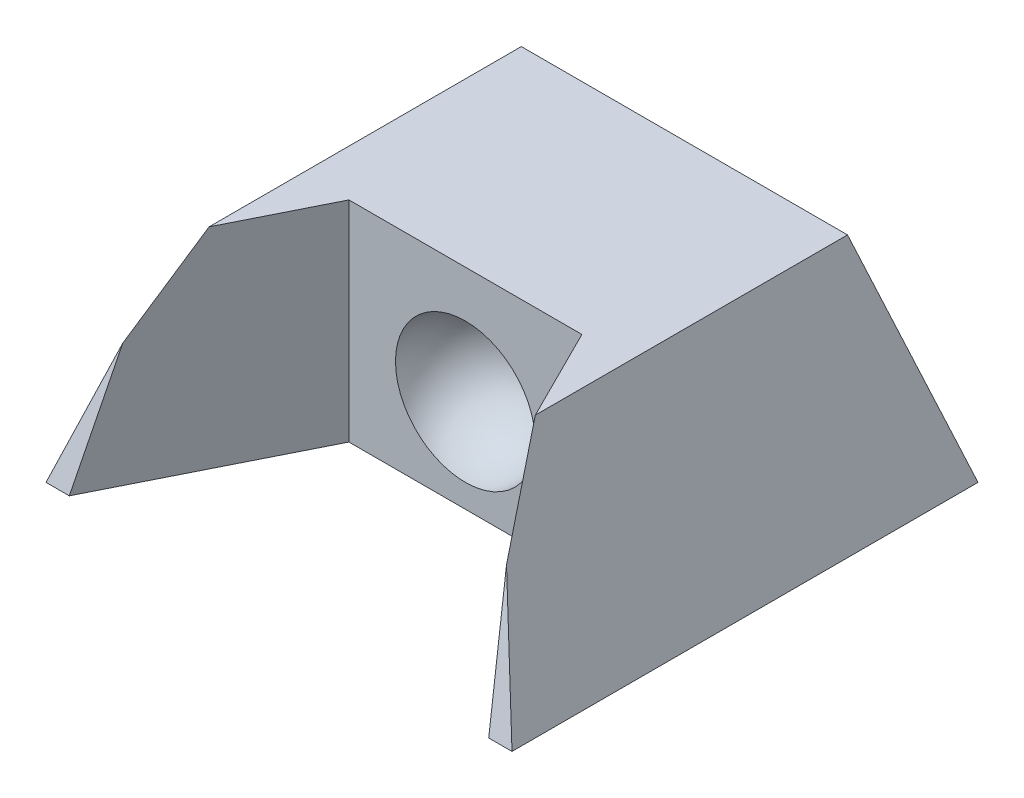
from build123d import *

# Parameters (mm, degrees)
GRUNDK_RPER_DEPTH               = 100
SCHRAEGEN_VORNE_DEPTH           = 100
SCHNITT_LINEAR_AUSTRAGEN4_DEPTH = 45
WANDUNG1_T                      = -1.75


with BuildPart() as part:
    # Skizze1 → Grundkörper (new body)
    with BuildSketch(Plane.XY):
        Polygon((0, 0), (100, 0), (85, 45), (15, 45), align=None)
    extrude(amount=-GRUNDK_RPER_DEPTH)

    # Skizze2 → Schraegen_vorne (cut)
    with BuildSketch(Plane(origin=(0, 0, 0), x_dir=(0, 0, -1), z_dir=(1, 0, 0))):
        Polygon((100, 0), (87, 45), (100, 45), align=None)
    schraegen_vorne = extrude(amount=SCHRAEGEN_VORNE_DEPTH, mode=Mode.SUBTRACT)

    # Spiegel_Schraege_hinten: Schraegen_vorne across plane
    add(schraegen_vorne.mirror(Plane.XY.offset(-50)), mode=Mode.SUBTRACT)

    # Skizze4 → Schnitt-Linear austragen4 (cut)
    with BuildSketch(Plane.XZ):
        Polygon((5, 0), (95, 0), (75, -40), (25, -40), align=None)
    extrude(amount=-SCHNITT_LINEAR_AUSTRAGEN4_DEPTH, mode=Mode.SUBTRACT)

    # Skizze6 → Schnitt-Rotation1 (revolve, cut)
    with BuildSketch(Plane.ZY.offset(-50), mode=Mode.PRIVATE) as schnitt_rotation1_sk:
        with BuildLine():
            Line((-55, 20), (-40, 20))
            Line((-40, 20), (-40, 5))
            ThreePointArc((-40, 5), (-50.606601718, 9.393398282), (-55, 20))
        make_face()
    revolve(schnitt_rotation1_sk.sketch.rotate(Axis((50, 20, -127.890936505), (0, 0, 1)), 180), axis=Axis((50, 20, -127.890936505), (0, 0, 1)), mode=Mode.SUBTRACT)

    # Wandung1
    wandung1_openings = [part.faces().sort_by_distance(p)[0] for p in [
        (50, 0, -62.407407407),
    ]]
    offset(amount=WANDUNG1_T, openings=wandung1_openings, kind=Kind.INTERSECTION)


solid = part.part
